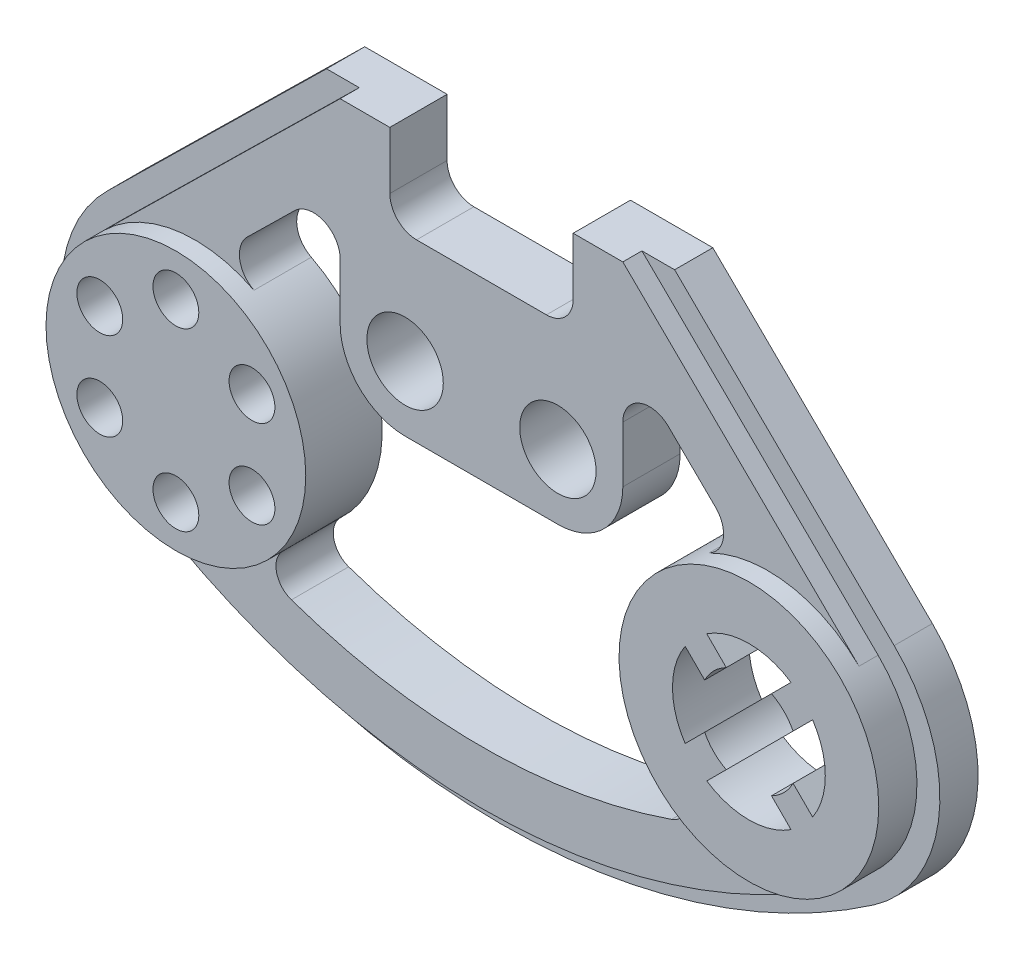
from build123d import *

# Parameters (mm, degrees)
EXTRUDE_1_DEPTH = 10
SKETCH_1_3_R    = 34
SKETCH_1_3_R_2  = 6
EXTRUDE_2_DEPTH = 20
SKETCH_1_4_R    = 10
EXTRUDE_3_DEPTH = 15


with BuildPart() as part:
    # Эскиз1 → Бобышка-Вытянуть1 (new body)
    with BuildSketch(Plane.XY):
        with BuildLine():
            Line((120.561139783, 85), (112, 85))
            Line((112, 85), (173.82860287, 24.252787165))
            ThreePointArc((173.82860287, 24.252787165), (181.354206237, 13.149667342), (184, 0))
            ThreePointArc((184, 0), (180.106628687, -15.798446414), (169.318181818, -27.97870353))
            ThreePointArc((169.318181818, -27.97870353), (75, -57.376798059), (-19.318181818, -27.97870353))
            ThreePointArc((-19.318181818, -27.97870353), (-33.873934113, -2.92516456), (-23.82860287, 24.252787165))
            Line((-23.82860287, 24.252787165), (38, 85))
            Line((38, 85), (29.438860217, 85))
            Line((29.438860217, 85), (-28.033650435, 28.532690783))
            ThreePointArc((-28.033650435, 28.532690783), (-39.851687192, -3.441370071), (-22.727272727, -32.9161218))
            ThreePointArc((-22.727272727, -32.9161218), (75, -63.376798059), (172.727272727, -32.9161218))
            ThreePointArc((172.727272727, -32.9161218), (189.851687192, -3.441370071), (178.033650435, 28.532690783))
            Line((178.033650435, 28.532690783), (120.561139783, 85))
        make_face()
    extrude(amount=EXTRUDE_1_DEPTH)

    # Эскиз1<3> → Бобышка-Вытянуть2 (add)
    # profile 1 of 2: a face of its own
    with BuildSketch(Plane.XY):
        with Locations((150, 0)):
            Circle(SKETCH_1_3_R)
        with BuildLine():
            ThreePointArc((133.315166415, -11.027979336), (130, 0), (133.315166415, 11.027979336))
            Line((133.315166415, 11.027979336), (138.425145033, 5.918000718))
            ThreePointArc((138.425145033, 5.918000718), (140.807611845, 9.192388155), (144.081999282, 11.574854967))
            Line((144.081999282, 11.574854967), (138.972020664, 16.684833585))
            ThreePointArc((138.972020664, 16.684833585), (150, 20), (161.027979336, 16.684833585))
            Line((161.027979336, 16.684833585), (155.918000718, 11.574854967))
            ThreePointArc((155.918000718, 11.574854967), (159.192388155, 9.192388155), (161.574854967, 5.918000718))
            Line((161.574854967, 5.918000718), (166.684833585, 11.027979336))
            ThreePointArc((166.684833585, 11.027979336), (170, 0), (166.684833585, -11.027979336))
            Line((166.684833585, -11.027979336), (161.574854967, -5.918000718))
            ThreePointArc((161.574854967, -5.918000718), (159.192388155, -9.192388155), (155.918000718, -11.574854967))
            Line((155.918000718, -11.574854967), (161.027979336, -16.684833585))
            ThreePointArc((161.027979336, -16.684833585), (150, -20), (138.972020664, -16.684833585))
            Line((138.972020664, -16.684833585), (144.081999282, -11.574854967))
            ThreePointArc((144.081999282, -11.574854967), (140.807611845, -9.192388155), (138.425145033, -5.918000718))
            Line((138.425145033, -5.918000718), (133.315166415, -11.027979336))
        make_face(mode=Mode.SUBTRACT)
    # profile 2 of 2: a face of its own
    with BuildSketch(Plane.XY):
        Circle(SKETCH_1_3_R)
        with Locations((-19.918584287, -11.5)):
            Circle(SKETCH_1_3_R_2, mode=Mode.SUBTRACT)
        with Locations((0, -23)):
            Circle(SKETCH_1_3_R_2, mode=Mode.SUBTRACT)
        with Locations((19.918584287, -11.5)):
            Circle(SKETCH_1_3_R_2, mode=Mode.SUBTRACT)
        with Locations((-19.918584287, 11.5)):
            Circle(SKETCH_1_3_R_2, mode=Mode.SUBTRACT)
        with Locations((0, 23)):
            Circle(SKETCH_1_3_R_2, mode=Mode.SUBTRACT)
        with Locations((19.918584287, 11.5)):
            Circle(SKETCH_1_3_R_2, mode=Mode.SUBTRACT)
    extrude(amount=EXTRUDE_2_DEPTH)

    # Эскиз1<4> → Бобышка-Вытянуть3 (add)
    # profile 1 of 2: a face of its own
    with BuildSketch(Plane.XY):
        with BuildLine():
            Line((173.82860287, 24.252787165), (112, 85))
            Line((112, 85), (99, 85))
            Line((99, 85), (99, 70))
            ThreePointArc((99, 70), (96.949747468, 65.050252532), (92, 63))
            Line((92, 63), (58, 63))
            ThreePointArc((58, 63), (53.050252532, 65.050252532), (51, 70))
            Line((51, 70), (51, 85))
            Line((51, 85), (38, 85))
            Line((38, 85), (-23.82860287, 24.252787165))
            ThreePointArc((-23.82860287, 24.252787165), (-5.164889991, 33.605414912), (15.445958822, 30.28898077))
            ThreePointArc((15.445958822, 30.28898077), (11.707247274, 35.461587695), (13.720120341, 41.518168286))
            Line((13.720120341, 41.518168286), (26.094111174, 53.675736464))
            ThreePointArc((26.094111174, 53.675736464), (33.707284453, 55.137793332), (38, 48.682515577))
            Line((38, 48.682515577), (38, 34))
            ThreePointArc((38, 34), (42.97918472, 21.97918472), (55, 17))
            Line((55, 17), (95, 17))
            ThreePointArc((95, 17), (107.02081528, 21.97918472), (112, 34))
            Line((112, 34), (112, 48.682515577))
            ThreePointArc((112, 48.682515577), (116.292715547, 55.137793332), (123.905888826, 53.675736464))
            Line((123.905888826, 53.675736464), (136.279879659, 41.518168286))
            ThreePointArc((136.279879659, 41.518168286), (138.292752726, 35.461587695), (134.554041178, 30.28898077))
            ThreePointArc((134.554041178, 30.28898077), (155.164889991, 33.605414912), (173.82860287, 24.252787165))
        make_face()
        with Locations((55, 34)):
            Circle(SKETCH_1_4_R, mode=Mode.SUBTRACT)
        with Locations((95, 34)):
            Circle(SKETCH_1_4_R, mode=Mode.SUBTRACT)
    # profile 2 of 2: a face of its own
    with BuildSketch(Plane.XY):
        with BuildLine():
            ThreePointArc((-19.318181818, -27.97870353), (75, -57.376798059), (169.318181818, -27.97870353))
            ThreePointArc((169.318181818, -27.97870353), (147.563945827, -33.912617712), (126.881190396, -24.930315732))
            ThreePointArc((126.881190396, -24.930315732), (128.673214982, -30.563393481), (124.765841582, -34.999083974))
            ThreePointArc((124.765841582, -34.999083974), (75, -43.376798059), (25.234158418, -34.999083974))
            ThreePointArc((25.234158418, -34.999083974), (21.326785018, -30.563393481), (23.118809604, -24.930315732))
            ThreePointArc((23.118809604, -24.930315732), (2.436054173, -33.912617712), (-19.318181818, -27.97870353))
        make_face()
    extrude(amount=EXTRUDE_3_DEPTH)


solid = part.part
